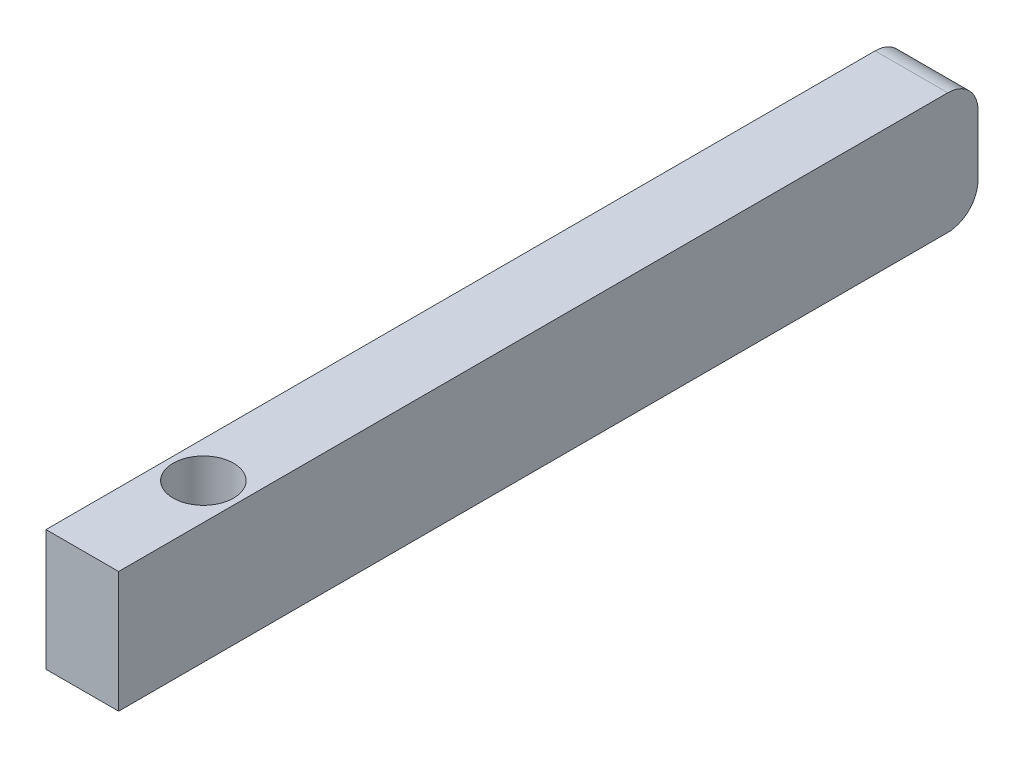
from build123d import *

# Parameters (mm, degrees)
SKETCH_1_W      = 1.2
SKETCH_1_H      = 7.2
SKETCH_1_H_2    = 7
SKETCH_1_R      = 0.5
EXTRUDE_1_DEPTH = 2
FILLET_1_R      = 0.5


with BuildPart() as part:
    # 草图1 → 凸台-拉伸1 (new body)
    # profile 1 of 2: a face of its own
    with BuildSketch(Plane(origin=(0, 0, 0), x_dir=(1, 0, 0), z_dir=(0, 1, 0))):
        with Locations((0, 8.6)):
            Rectangle(SKETCH_1_W, SKETCH_1_H)
    # profile 2 of 2: a face of its own
    with BuildSketch(Plane(origin=(0, 0, 0), x_dir=(1, 0, 0), z_dir=(0, 1, 0))):
        with Locations((0, 1.5)):
            Rectangle(SKETCH_1_W, SKETCH_1_H_2)
        with Locations(Location((0, 0, 0), (0, 0, 270))):
            Circle(SKETCH_1_R, mode=Mode.SUBTRACT)
    extrude(amount=EXTRUDE_1_DEPTH)

    # 圆角1
    fillet_1_edges = [part.edges().sort_by_distance(p)[0] for p in [
        (0, 2, -12.2),
        (0, 0, -12.2),
    ]]
    fillet(fillet_1_edges, radius=FILLET_1_R)


solid = part.part
